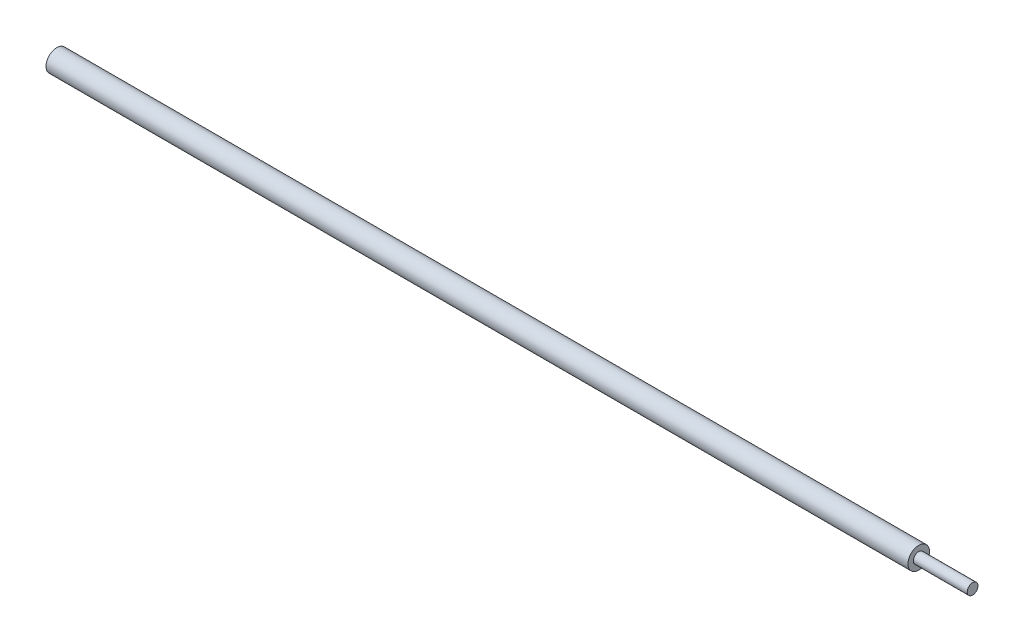
from build123d import *

# Parameters (mm, degrees)
SKETCH1_W           = 80
SKETCH1_H           = 1
SKETCH2_R           = 0.5
BOSS_EXTRUDE1_DEPTH = 5


with BuildPart() as part:
    # Sketch1 → Revolve-Thin1 (revolve)
    with BuildSketch(Plane.XY, mode=Mode.PRIVATE) as revolve_thin1_sk:
        with Locations((3.285394164, 0.5)):
            Rectangle(SKETCH1_W, SKETCH1_H)
    revolve(revolve_thin1_sk.sketch.rotate(Axis((-36.714605836, 0, 0), (1, 0, 0)), 90), axis=Axis((-36.714605836, 0, 0), (1, 0, 0)))

    # Sketch2 → Boss-Extrude1 (add)
    with BuildSketch(Plane(origin=(43.285394164, 0, 0), x_dir=(0, 0, -1), z_dir=(1, 0, 0))):
        Circle(SKETCH2_R)
    extrude(amount=BOSS_EXTRUDE1_DEPTH)


solid = part.part
